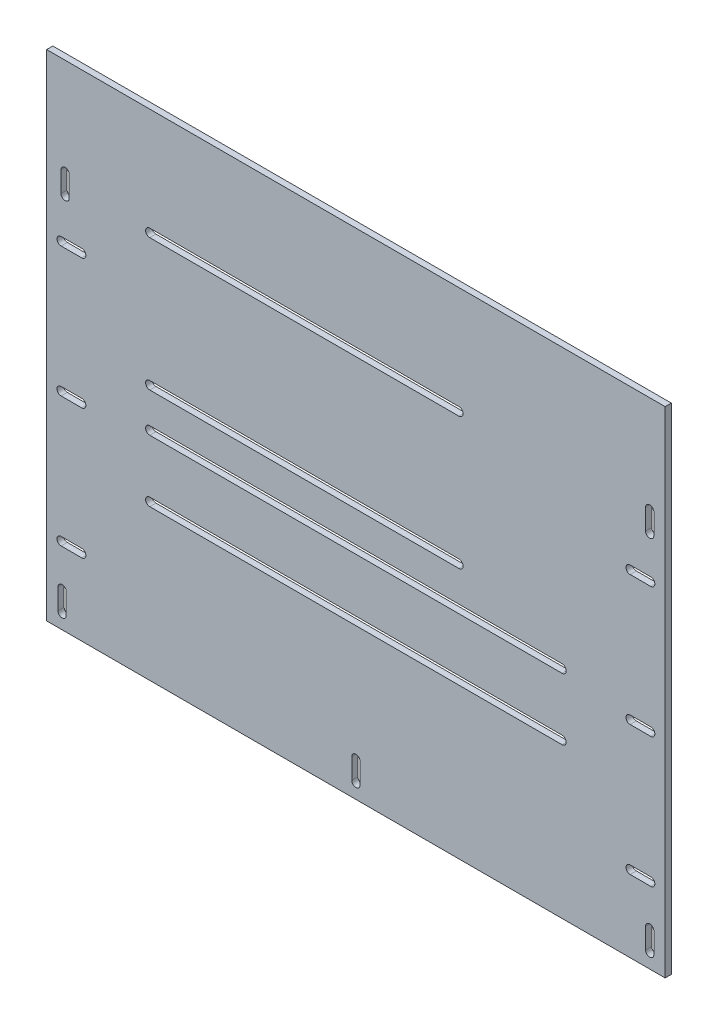
from build123d import *

# Parameters (mm, degrees)
SKETCH1_W           = 300
SKETCH1_H           = 200
BOSS_EXTRUDE1_DEPTH = 3
CUT_EXTRUDE1_DEPTH  = 3
CUT_EXTRUDE2_DEPTH  = 10
CUT_EXTRUDE3_DEPTH  = 10
CUT_EXTRUDE4_DEPTH  = 10
CUT_EXTRUDE5_DEPTH  = 10
CUT_EXTRUDE6_DEPTH  = 10
CUT_EXTRUDE7_DEPTH  = 10
CUT_EXTRUDE8_DEPTH  = 10
SKETCH10_W          = 300
SKETCH10_H          = 3
BOSS_EXTRUDE2_DEPTH = 40


with BuildPart() as part:
    # Sketch1 → Boss-Extrude1 (new body)
    with BuildSketch(Plane.XY):
        Rectangle(SKETCH1_W, SKETCH1_H)
    extrude(amount=BOSS_EXTRUDE1_DEPTH)

    # Sketch2 → Cut-Extrude1 (cut)
    with BuildSketch(Plane(origin=(0, 0, 0), x_dir=(-1, 0, 0), z_dir=(0, 0, -1))):
        with BuildLine():
            Line((-100, -23), (100, -23))
            ThreePointArc((100, -23), (102, -25), (100, -27))
            Line((100, -27), (-100, -27))
            ThreePointArc((-100, -27), (-102, -25), (-100, -23))
        make_face()
        with BuildLine():
            Line((-100, 7), (100, 7))
            ThreePointArc((100, 7), (102, 5), (100, 3))
            Line((100, 3), (-100, 3))
            ThreePointArc((-100, 3), (-102, 5), (-100, 7))
        make_face()
        with BuildLine():
            Line((-50, 26), (100, 26))
            ThreePointArc((100, 26), (102, 24), (100, 22))
            Line((100, 22), (-50, 22))
            ThreePointArc((-50, 22), (-52, 24), (-50, 26))
        make_face()
        with BuildLine():
            Line((-50, 90), (100, 90))
            ThreePointArc((100, 90), (102, 88), (100, 86))
            Line((100, 86), (-50, 86))
            ThreePointArc((-50, 86), (-52, 88), (-50, 90))
        make_face()
    extrude(amount=-CUT_EXTRUDE1_DEPTH, mode=Mode.SUBTRACT)

    # Sketch3 → Cut-Extrude2 (cut)
    with BuildSketch(Plane(origin=(0, 0, 0), x_dir=(-1, 0, 0), z_dir=(0, 0, -1))):
        with BuildLine():
            Line((143.044786866, 93), (143.044786866, 83))
            ThreePointArc((143.044786866, 83), (141.044786866, 81), (139.044786866, 83))
            Line((139.044786866, 83), (139.044786866, 93))
            ThreePointArc((139.044786866, 93), (141.044786866, 95), (143.044786866, 93))
        make_face()
    extrude(amount=-CUT_EXTRUDE2_DEPTH, mode=Mode.SUBTRACT)

    # Sketch4 → Cut-Extrude3 (cut)
    with BuildSketch(Plane(origin=(0, 0, 0), x_dir=(-1, 0, 0), z_dir=(0, 0, -1))):
        with BuildLine():
            Line((144.5, -83), (144.5, -93))
            ThreePointArc((144.5, -93), (142.5, -95), (140.5, -93))
            Line((140.5, -93), (140.5, -83))
            ThreePointArc((140.5, -83), (142.5, -81), (144.5, -83))
        make_face()
    extrude(amount=-CUT_EXTRUDE3_DEPTH, mode=Mode.SUBTRACT)

    # Sketch5 → Cut-Extrude4 (cut)
    with BuildSketch(Plane(origin=(0, 0, 0), x_dir=(-1, 0, 0), z_dir=(0, 0, -1))):
        with BuildLine():
            Line((-140.5, 93), (-140.5, 83))
            ThreePointArc((-140.5, 83), (-142.5, 81), (-144.5, 83))
            Line((-144.5, 83), (-144.5, 93))
            ThreePointArc((-144.5, 93), (-142.5, 95), (-140.5, 93))
        make_face()
    extrude(amount=-CUT_EXTRUDE4_DEPTH, mode=Mode.SUBTRACT)

    # Sketch6 → Cut-Extrude5 (cut)
    with BuildSketch(Plane(origin=(0, 0, 0), x_dir=(-1, 0, 0), z_dir=(0, 0, -1))):
        with BuildLine():
            Line((-140.5, -83), (-140.5, -93))
            ThreePointArc((-140.5, -93), (-142.5, -95), (-144.5, -93))
            Line((-144.5, -93), (-144.5, -83))
            ThreePointArc((-144.5, -83), (-142.5, -81), (-140.5, -83))
        make_face()
    extrude(amount=-CUT_EXTRUDE5_DEPTH, mode=Mode.SUBTRACT)

    # Sketch7 → Cut-Extrude6 (cut)
    with BuildSketch(Plane(origin=(0, 0, 0), x_dir=(-1, 0, 0), z_dir=(0, 0, -1))):
        with BuildLine():
            Line((2, -83), (2, -93))
            ThreePointArc((2, -93), (0, -95), (-2, -93))
            Line((-2, -93), (-2, -83))
            ThreePointArc((-2, -83), (0, -81), (2, -83))
        make_face()
    extrude(amount=-CUT_EXTRUDE6_DEPTH, mode=Mode.SUBTRACT)

    # Sketch8 → Cut-Extrude7 (cut)
    with BuildSketch(Plane(origin=(0, 0, 0), x_dir=(-1, 0, 0), z_dir=(0, 0, -1))):
        with BuildLine():
            Line((-143, 65), (-133, 65))
            ThreePointArc((-133, 65), (-131, 63), (-133, 61))
            Line((-133, 61), (-143, 61))
            ThreePointArc((-143, 61), (-145, 63), (-143, 65))
        make_face()
        with BuildLine():
            Line((-143, -61), (-133, -61))
            ThreePointArc((-133, -61), (-131, -63), (-133, -65))
            Line((-133, -65), (-143, -65))
            ThreePointArc((-143, -65), (-145, -63), (-143, -61))
        make_face()
        with BuildLine():
            Line((-143, 2), (-133, 2))
            ThreePointArc((-133, 2), (-131, 0), (-133, -2))
            Line((-133, -2), (-143, -2))
            ThreePointArc((-143, -2), (-145, 0), (-143, 2))
        make_face()
    extrude(amount=-CUT_EXTRUDE7_DEPTH, mode=Mode.SUBTRACT)

    # Sketch9 → Cut-Extrude8 (cut)
    with BuildSketch(Plane(origin=(0, 0, 0), x_dir=(-1, 0, 0), z_dir=(0, 0, -1))):
        with BuildLine():
            Line((133, 65), (143, 65))
            ThreePointArc((143, 65), (145, 63), (143, 61))
            Line((143, 61), (133, 61))
            ThreePointArc((133, 61), (131, 63), (133, 65))
        make_face()
        with BuildLine():
            Line((133, 2), (143, 2))
            ThreePointArc((143, 2), (145, 0), (143, -2))
            Line((143, -2), (133, -2))
            ThreePointArc((133, -2), (131, 0), (133, 2))
        make_face()
        with BuildLine():
            Line((133, -61), (143, -61))
            ThreePointArc((143, -61), (145, -63), (143, -65))
            Line((143, -65), (133, -65))
            ThreePointArc((133, -65), (131, -63), (133, -61))
        make_face()
    extrude(amount=-CUT_EXTRUDE8_DEPTH, mode=Mode.SUBTRACT)

    # Sketch10 → Boss-Extrude2 (add)
    with BuildSketch(Plane(origin=(0, 100, 0), x_dir=(1, 0, 0), z_dir=(0, 1, 0))):
        with Locations((0, -1.5)):
            Rectangle(SKETCH10_W, SKETCH10_H)
    extrude(amount=BOSS_EXTRUDE2_DEPTH)


solid = part.part
